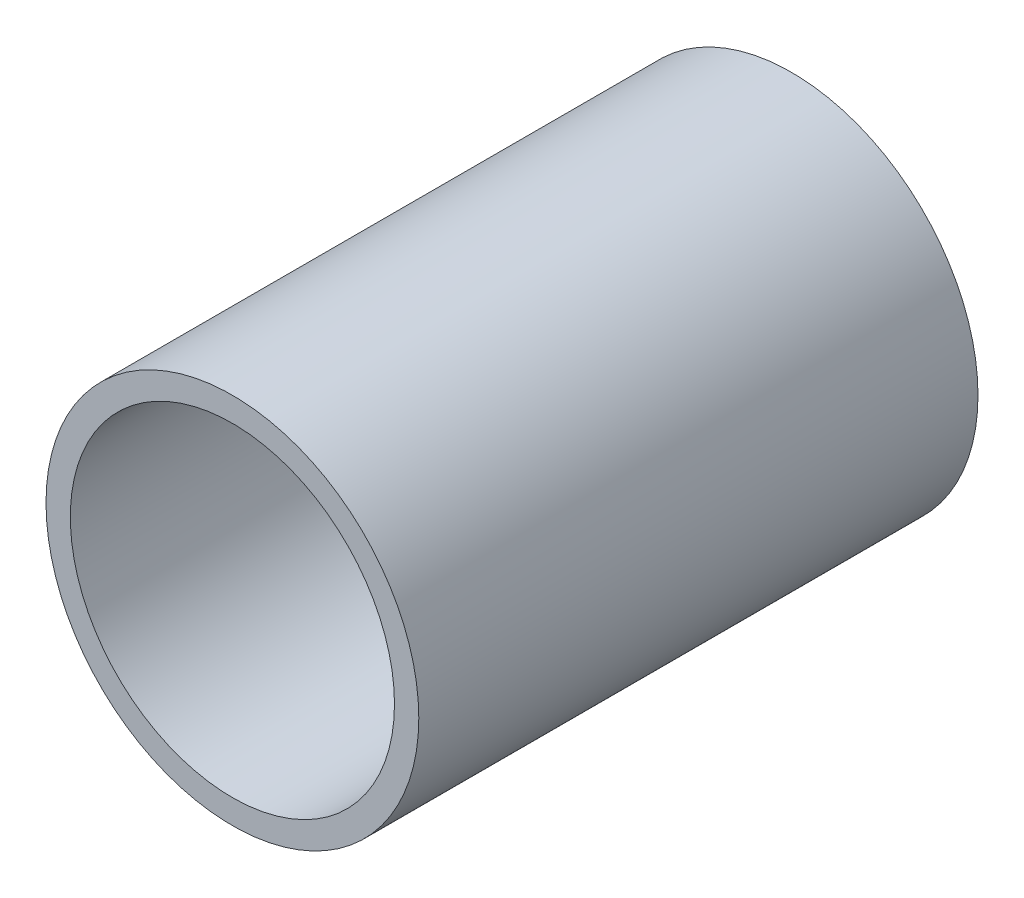
from build123d import *

# Parameters (mm, degrees)
SKETCH1_R           = 23
SKETCH1_R_2         = 20
BOSS_EXTRUDE1_DEPTH = 69


with BuildPart() as part:
    # Sketch1 → Boss-Extrude1 (new body)
    with BuildSketch(Plane.XY):
        Circle(SKETCH1_R)
        Circle(SKETCH1_R_2, mode=Mode.SUBTRACT)
    extrude(amount=BOSS_EXTRUDE1_DEPTH)


solid = part.part
